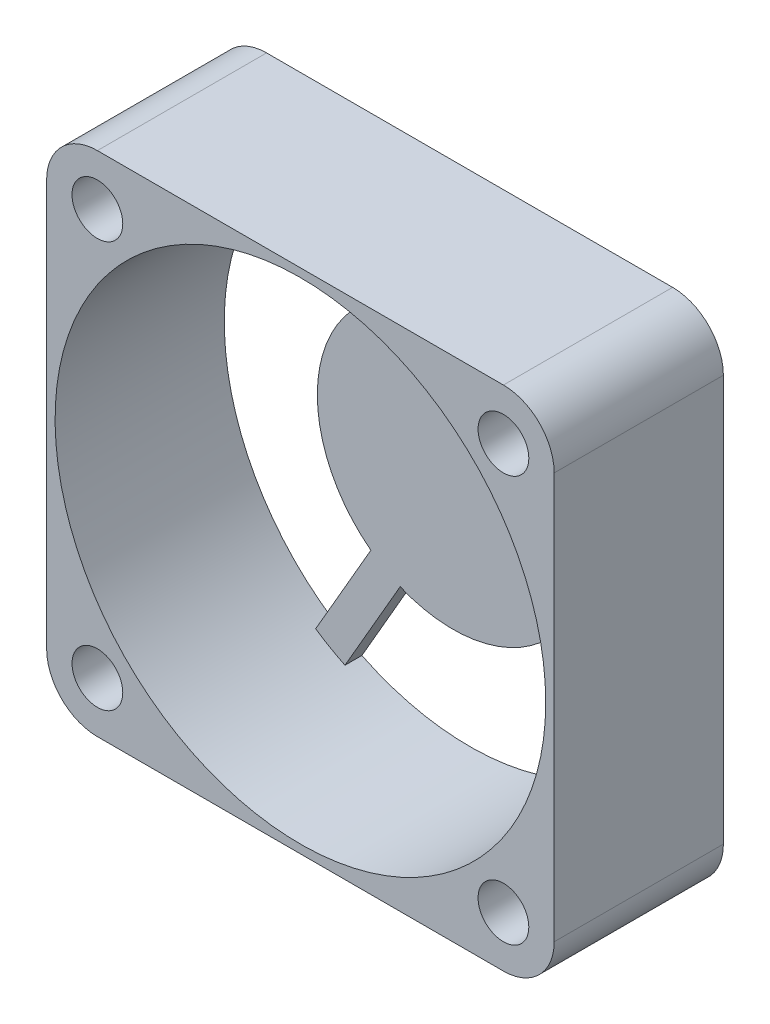
from build123d import *

# Parameters (mm, degrees)
SKICA1_R                = 1.5
SKICA1_R_2              = 14.5
P_IDAT_VYSUNUT_M1_DEPTH = 10
SKICA2_R                = 8
P_IDAT_VYSUNUT_M2_DEPTH = 1


with BuildPart() as part:
    # Skica1 → Přidat vysunutím1 (new body)
    with BuildSketch(Plane.XY):
        with BuildLine():
            Line((-15, 12), (-15, 0))
            Line((-15, 0), (-15, -12))
            ThreePointArc((-15, -12), (-14.121320344, -14.121320344), (-12, -15))
            Line((-12, -15), (12, -15))
            ThreePointArc((12, -15), (14.121320344, -14.121320344), (15, -12))
            Line((15, -12), (15, 12))
            ThreePointArc((15, 12), (14.121320344, 14.121320344), (12, 15))
            Line((12, 15), (-12, 15))
            ThreePointArc((-12, 15), (-14.121320344, 14.121320344), (-15, 12))
        make_face()
        with Locations((-12, -12)):
            Circle(SKICA1_R, mode=Mode.SUBTRACT)
        with Locations((12, -12)):
            Circle(SKICA1_R, mode=Mode.SUBTRACT)
        with Locations((-12, 12)):
            Circle(SKICA1_R, mode=Mode.SUBTRACT)
        Circle(SKICA1_R_2, mode=Mode.SUBTRACT)
        with Locations((12, 12)):
            Circle(SKICA1_R, mode=Mode.SUBTRACT)
    extrude(amount=P_IDAT_VYSUNUT_M1_DEPTH)

    # Skica2 → Přidat vysunutím2 (add)
    with BuildSketch(Plane.XY):
        with BuildLine():
            ThreePointArc((-4.83465237, 6.373863542), (-4, 6.92820323), (-3.102601563, 7.373863542))
            Line((-3.102601563, 7.373863542), (-6.366712667, 13.027469816))
            ThreePointArc((-6.366712667, 13.027469816), (-7.25, 12.557368355), (-8.098763475, 12.027469816))
            Line((-8.098763475, 12.027469816), (-4.83465237, 6.373863542))
        make_face()
        Circle(SKICA2_R)
        with BuildLine():
            Line((14.465476141, 1), (7.937253933, 1))
            ThreePointArc((7.937253933, 1), (7.984298074, 0.5009833), (8, 0))
            ThreePointArc((8, 0), (7.984298074, -0.5009833), (7.937253933, -1))
            Line((7.937253933, -1), (14.465476141, -1))
            ThreePointArc((14.465476141, -1), (14.491366465, -0.500297885), (14.5, 0))
            ThreePointArc((14.5, 0), (14.491366465, 0.500297885), (14.465476141, 1))
        make_face()
        with BuildLine():
            Line((-6.366712667, -13.027469816), (-3.102601563, -7.373863542))
            ThreePointArc((-3.102601563, -7.373863542), (-4, -6.92820323), (-4.83465237, -6.373863542))
            Line((-4.83465237, -6.373863542), (-8.098763475, -12.027469816))
            ThreePointArc((-8.098763475, -12.027469816), (-7.25, -12.557368355), (-6.366712667, -13.027469816))
        make_face()
    extrude(amount=P_IDAT_VYSUNUT_M2_DEPTH)


solid = part.part
